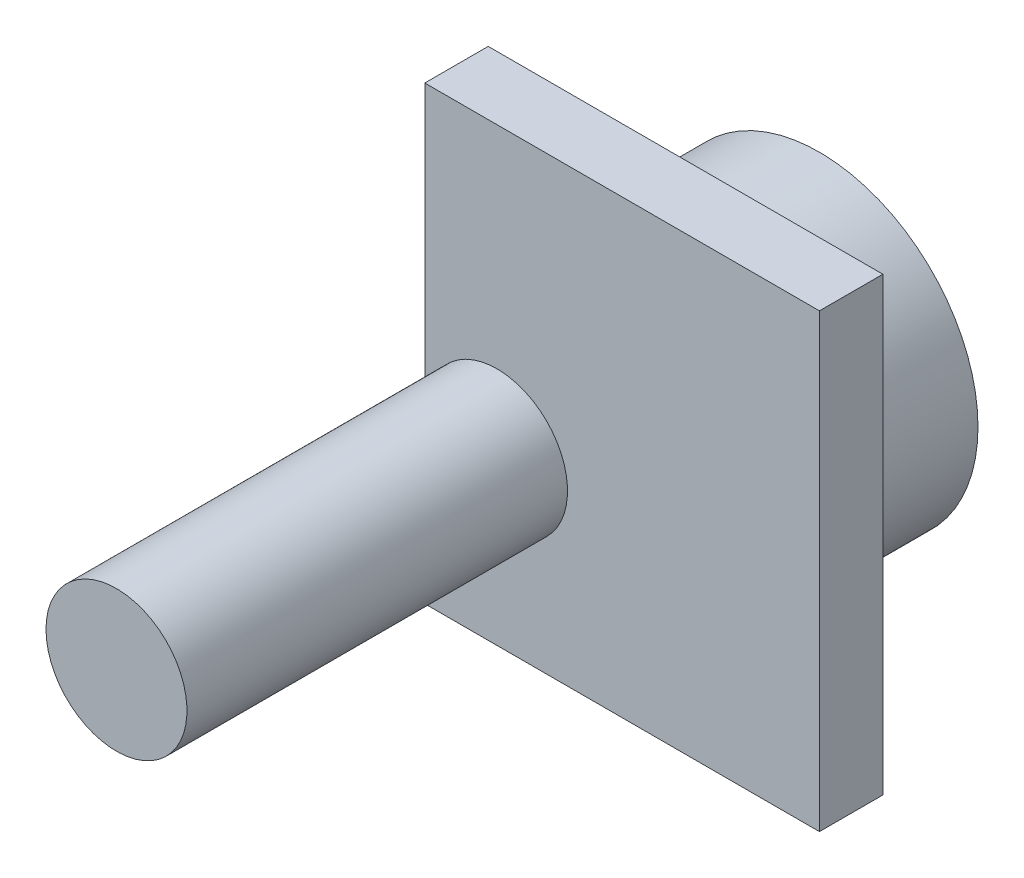
from build123d import *

# Parameters (mm, degrees)
SKETCH_1_R          = 4.5
EXTRUDE_1_DEPTH     = 4
SKETCH_2_W          = 11.2
SKETCH_2_H          = 13.8
EXTRUDE_2_DEPTH     = 1.8
SKETCH_3_R          = 3
CUT_EXTRUDE_1_DEPTH = 1
SKETCH_5_R          = 3
BLACK_DEPTH         = 1
SKETCH_4_R          = 2
EXTRUDE_5_DEPTH     = 10.8
SKETCH_6_W          = 11.2
SKETCH_6_H          = 1
CUT_EXTRUDE_2_DEPTH = 2


with BuildPart() as part:
    # Эскиз1 → Бобышка-Вытянуть1 (new body)
    with BuildSketch(Plane.XY):
        Circle(SKETCH_1_R)
    extrude(amount=EXTRUDE_1_DEPTH)

    # Эскиз2 → Бобышка-Вытянуть2 (add)
    with BuildSketch(Plane.XY.offset(4)):
        with Locations((0.2, 0.5)):
            Rectangle(SKETCH_2_W, SKETCH_2_H)
    extrude(amount=EXTRUDE_2_DEPTH)

    # Эскиз3 → Вырез-Вытянуть1 (cut)
    with BuildSketch(Plane(origin=(0, 0, 0), x_dir=(-1, 0, 0), z_dir=(0, 0, -1))):
        Circle(SKETCH_3_R)
    extrude(amount=-CUT_EXTRUDE_1_DEPTH, mode=Mode.SUBTRACT)

    # Эскиз4 → Бобышка-Вытянуть5 (add)
    with BuildSketch(Plane.XY.offset(5.8)):
        with Locations((-3.35, -1.6)):
            Circle(SKETCH_4_R)
    extrude(amount=EXTRUDE_5_DEPTH)

    # Эскиз6 → Вырез-Вытянуть2 (cut)
    with BuildSketch(Plane.XY.offset(5.8)):
        with Locations((0.2, 6.9)):
            Rectangle(SKETCH_6_W, SKETCH_6_H)
    extrude(amount=-CUT_EXTRUDE_2_DEPTH, mode=Mode.SUBTRACT)


with BuildPart() as body_2:
    # Эскиз5 → black (new body)
    with BuildSketch(Plane(origin=(0, 0, 1), x_dir=(-1, 0, 0), z_dir=(0, 0, -1))):
        Circle(SKETCH_5_R)
    extrude(amount=BLACK_DEPTH)


solid = Compound([part.part, body_2.part])
